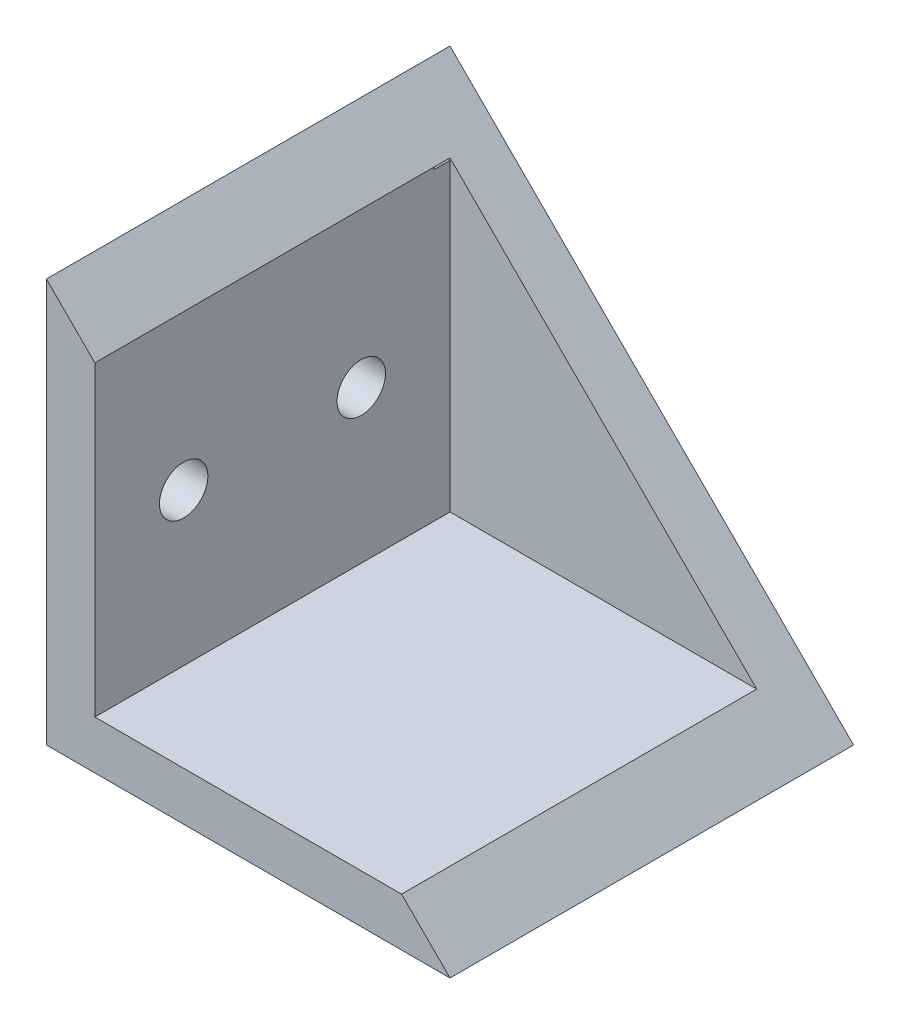
from build123d import *

# Parameters (mm, degrees)
BOSS_EXTRUDE2_DEPTH     = 25
CUT_EXTRUDE1_DEPTH      = 21
SKETCH3_W               = 26.870057685
SKETCH3_H               = 1
CUT_EXTRUDE3_DEPTH      = 0.1
CUT_EXTRUDE4_DEPTH      = 1
BOSS_EXTRUDE3_DEPTH     = 1
CUT_EXTRUDE5_DEPTH      = 15
CUT_EXTRUDE5_DEPTH_BACK = 18
SKETCH8_R               = 1.5


with BuildPart() as part:
    # Sketch1 → Boss-Extrude2 (new body)
    with BuildSketch(Plane.XY):
        Polygon((0, 24.307463671), (0, -0.692536329), (25, -0.692536329), align=None)
    extrude(amount=BOSS_EXTRUDE2_DEPTH)

    # Sketch2 → Cut-Extrude1 (cut)
    with BuildSketch(Plane.XY.offset(25)):
        Polygon((3, 21.307463671), (3, 2.307463671), (22, 2.307463671), align=None)
    extrude(amount=-CUT_EXTRUDE1_DEPTH, mode=Mode.SUBTRACT)

    # Sketch3 → Cut-Extrude3 (cut)
    with BuildSketch(Plane(origin=(12.153731836, 12.153731836, 0), x_dir=(0.7071067811865475, -0.7071067811865477, 0), z_dir=(0.7071067811865477, 0.7071067811865475, 0))):
        with Locations((0.489697135, -3.5)):
            Rectangle(SKETCH3_W, SKETCH3_H)
    extrude(amount=-CUT_EXTRUDE3_DEPTH, mode=Mode.SUBTRACT)

    # Sketch4 → Cut-Extrude4 (cut)
    with BuildSketch(Plane.XY.offset(4)):
        Polygon((3, 21.307463671), (3, 2.307463671), (22, 2.307463671), align=None)
    extrude(amount=-CUT_EXTRUDE4_DEPTH, mode=Mode.SUBTRACT)

    # Sketch5 → Boss-Extrude3 (add)
    with BuildSketch(Plane.XY.offset(3)):
        Polygon((22, 2.307463671), (21.858578644, 2.307463671), (21.929289322, 2.236752993), align=None)
    extrude(amount=BOSS_EXTRUDE3_DEPTH)

    # Sketch8 → Cut-Extrude5 (cut, two sides: drawn at the far end of the back side and taken through both)
    with BuildSketch(Plane(origin=(3, 0, 0), x_dir=(0, 0, -1), z_dir=(1, 0, 0)).offset(-CUT_EXTRUDE5_DEPTH_BACK)):
        with Locations(Location((-8.5, 11.736752993, 0), (0, 0, 270))):
            Circle(SKETCH8_R)
        with Locations(Location((-19.5, 11.736752993, 0), (0, 0, 270))):
            Circle(SKETCH8_R)
    extrude(amount=CUT_EXTRUDE5_DEPTH + CUT_EXTRUDE5_DEPTH_BACK, mode=Mode.SUBTRACT)


solid = part.part
